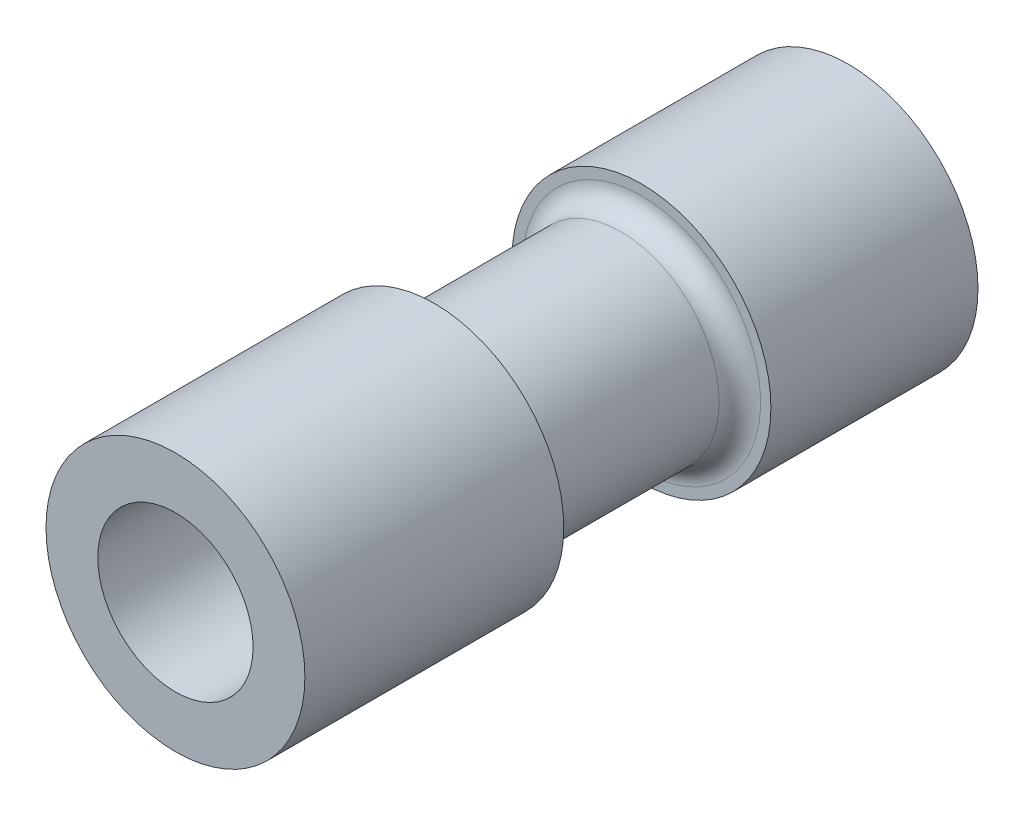
from build123d import *

# Parameters (mm, degrees)
SKETCH1_R                = 2.5
BOSS_EXTRUDE1_DEPTH      = 13
F_2_0_2_DIAMETER_HOLE1_D = 2
SKETCH8_R                = 1.5
CUT_EXTRUDE1_DEPTH       = 8


with BuildPart() as part:
    # Sketch1 → Boss-Extrude1 (new body)
    with BuildSketch(Plane.XY):
        with Locations(Location((0, 0, 0), (0, 0, 180))):
            Circle(SKETCH1_R)
    extrude(amount=BOSS_EXTRUDE1_DEPTH)

    # Sketch3 → Cut-Revolve1 (revolve, cut)
    with BuildSketch(Plane(origin=(0, 0, 0), x_dir=(1, 0, 0), z_dir=(0, 1, 0)), mode=Mode.PRIVATE) as cut_revolve1_sk:
        with BuildLine():
            Line((3.138230266, -4), (2.3, -4))
            ThreePointArc((2.3, -4), (2.017157288, -4.117157288), (1.9, -4.4))
            Line((1.9, -4.4), (1.9, -7.6))
            ThreePointArc((1.9, -7.6), (2.017157288, -7.882842712), (2.3, -8))
            Line((2.3, -8), (3.138230266, -8))
            Line((3.138230266, -8), (3.138230266, -4))
        make_face()
    revolve(cut_revolve1_sk.sketch.rotate(Axis((0, 0, 0), (0, 0, 1)), 180), axis=Axis((0, 0, 0), (0, 0, 1)), mode=Mode.SUBTRACT)

    # Ø2.0 (2) Diameter Hole1 (through all)
    with Locations(Plane.XY.offset(13)):
        with Locations((0, 0)):
            Hole(F_2_0_2_DIAMETER_HOLE1_D / 2)

    # Sketch8 → Cut-Extrude1 (cut)
    with BuildSketch(Plane.XY.offset(13)):
        Circle(SKETCH8_R)
    extrude(amount=-CUT_EXTRUDE1_DEPTH, mode=Mode.SUBTRACT)


solid = part.part
